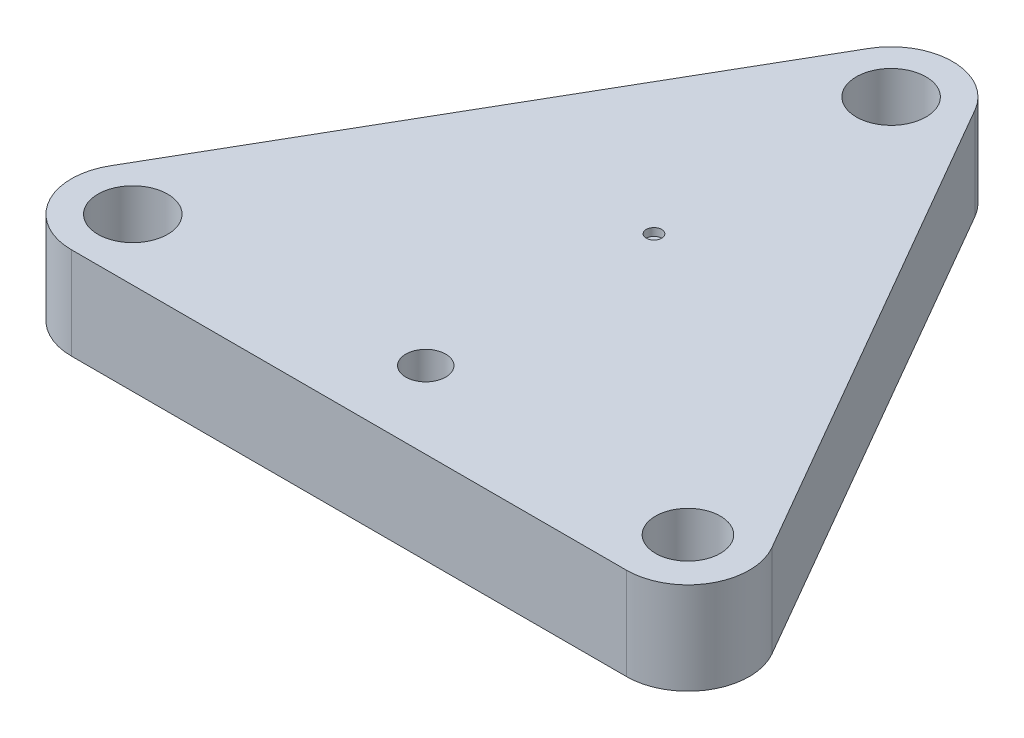
from build123d import *

# Parameters (mm, degrees)
SKETCH1_R           = 1.135
SKETCH1_R_2         = 1.054
BOSS_EXTRUDE1_DEPTH = 3
SKETCH2_R           = 0.65
CUT_EXTRUDE1_DEPTH  = 23.736281859
SKETCH4_R           = 0.25
CUT_EXTRUDE3_DEPTH  = 0.25


with BuildPart() as part:
    # Sketch1 → Boss-Extrude1 (new body)
    with BuildSketch(Plane(origin=(0, 0, 0), x_dir=(1, 0, 0), z_dir=(0, 1, 0))):
        with BuildLine():
            Line((0, 0), (9.035898385, 0))
            ThreePointArc((9.035898385, 0), (10.767949192, 1), (10.767949192, 3))
            Line((10.767949192, 3), (1.732050808, 18.650635095))
            ThreePointArc((1.732050808, 18.650635095), (0, 19.650635095), (-1.732050808, 18.650635095))
            Line((-1.732050808, 18.650635095), (-10.767949192, 3))
            ThreePointArc((-10.767949192, 3), (-10.767949192, 1), (-9.035898385, 0))
            Line((-9.035898385, 0), (0, 0))
        make_face()
        with Locations(Location((0, 17.650635095, 0), (0, 0, 270))):
            Circle(SKETCH1_R, mode=Mode.SUBTRACT)
        with Locations(Location((-9.035898385, 2, 0), (0, 0, 270))):
            Circle(SKETCH1_R, mode=Mode.SUBTRACT)
        with Locations(Location((9.035898385, 2, 0), (0, 0, 270))):
            Circle(SKETCH1_R_2, mode=Mode.SUBTRACT)
    extrude(amount=BOSS_EXTRUDE1_DEPTH)

    # Sketch2 → Cut-Extrude1 (cut, through all)
    with BuildSketch(Plane(origin=(0, 3, 0), x_dir=(1, 0, 0), z_dir=(0, 1, 0))):
        with Locations(Location((0, 2.5, 0), (0, 0, 270))):
            Circle(SKETCH2_R)
    extrude(amount=-CUT_EXTRUDE1_DEPTH, mode=Mode.SUBTRACT)

    # Sketch4 → Cut-Extrude3 (cut)
    with BuildSketch(Plane(origin=(0, 3, 0), x_dir=(1, 0, 0), z_dir=(0, 1, 0))):
        with Locations(Location((0, 9.930442918, 0), (0, 0, 270))):
            Circle(SKETCH4_R)
    extrude(amount=-CUT_EXTRUDE3_DEPTH, mode=Mode.SUBTRACT)


solid = part.part
